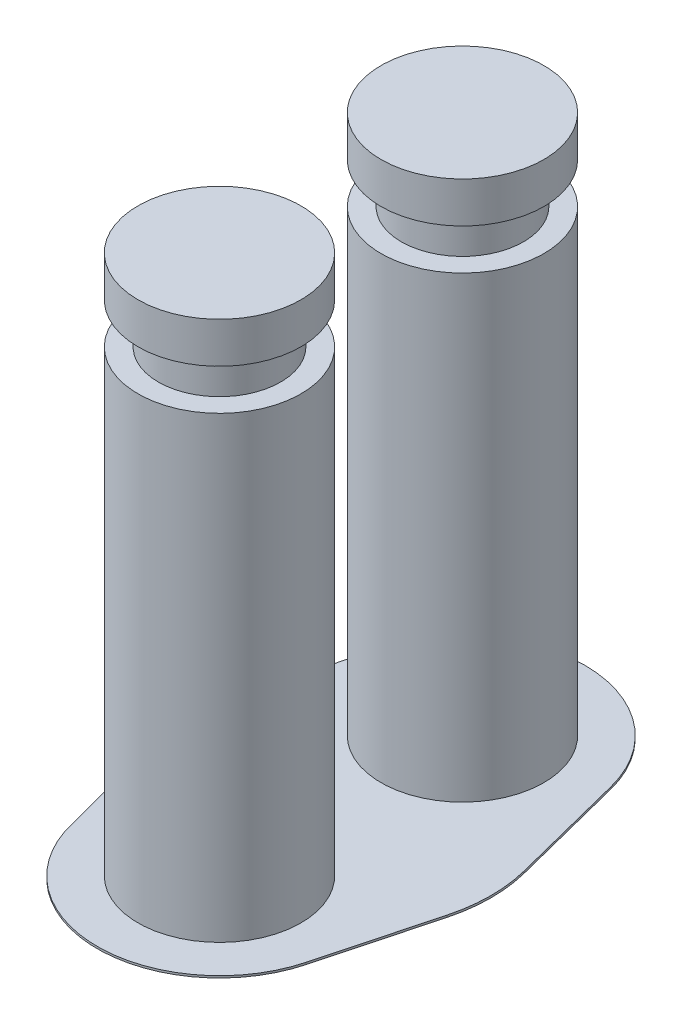
from build123d import *

# Parameters (mm, degrees)
BOSS_EXTRUDE2_DEPTH            = 0.1
SKETCH3_R                      = 4
BOSS_EXTRUDE3_DEPTH            = 22.5
SKETCH4_R                      = 3
BOSS_EXTRUDE4_DEPTH            = 2
SKETCH5_R                      = 4
BOSS_EXTRUDE5_DEPTH            = 2
SKETCH7_W                      = 1.89865
SKETCH7_H                      = 0.1
F_6_CLEARANCE_HOLE1_AT_2_COUNT = 2
F_6_CLEARANCE_HOLE1_AT_2_PITCH = 11.930689284
F_6_32_TAPPED_HOLE1_D          = 2.7051
F_6_32_TAPPED_HOLE1_DEPTH      = 9.39
F_6_32_TAPPED_HOLE1_TIP        = 0.81269403


with BuildPart() as part:
    # Sketch2 → Boss-Extrude2 (new body)
    with BuildSketch(Plane(origin=(0, 0, 0), x_dir=(1, 0, 0), z_dir=(0, 1, 0))):
        with BuildLine():
            ThreePointArc((-1.921673483, -7.798539123), (3.967844549, -11.837003018), (9.548776015, -7.381801872))
            Line((9.548776015, -7.381801872), (10.998470019, -1.926053578))
            ThreePointArc((10.998470019, -1.926053578), (11.24988985, -0.04064778), (11.018921171, 1.84737246))
            Line((11.018921171, 1.84737246), (9.565136937, 7.567628243))
            ThreePointArc((9.565136937, 7.567628243), (3.75, 12.089730275), (-2.065136937, 7.567628243))
            Line((-2.065136937, 7.567628243), (-3.518921171, 1.84737246))
            ThreePointArc((-3.518921171, 1.84737246), (-3.749830525, -0.050419155), (-3.493426606, -1.944934706))
            Line((-3.493426606, -1.944934706), (-1.921673483, -7.798539123))
        make_face()
    extrude(amount=BOSS_EXTRUDE2_DEPTH)

    # Sketch3 → Boss-Extrude3 (add)
    with BuildSketch(Plane(origin=(0, 0.1, 0), x_dir=(1, 0, 0), z_dir=(0, 1, 0))):
        with Locations(Location((3.75, -5.840959009, 0), (0, 0, 90))):
            Circle(SKETCH3_R)
        with Locations(Location((3.75, 6.089730275, 0), (0, 0, 90))):
            Circle(SKETCH3_R)
    extrude(amount=BOSS_EXTRUDE3_DEPTH)

    # Sketch4 → Boss-Extrude4 (add)
    with BuildSketch(Plane(origin=(0, 22.6, 0), x_dir=(1, 0, 0), z_dir=(0, 1, 0))):
        with Locations(Location((3.75, -5.840959009, 0), (0, 0, 270))):
            Circle(SKETCH4_R)
        with Locations(Location((3.75, 6.089730275, 0), (0, 0, 270))):
            Circle(SKETCH4_R)
    extrude(amount=BOSS_EXTRUDE4_DEPTH)

    # Sketch5 → Boss-Extrude5 (add)
    with BuildSketch(Plane(origin=(0, 24.6, 0), x_dir=(1, 0, 0), z_dir=(0, 1, 0))):
        with Locations(Location((3.75, -5.840959009, 0), (0, 0, 90))):
            Circle(SKETCH5_R)
        with Locations(Location((3.75, 6.089730275, 0), (0, 0, 90))):
            Circle(SKETCH5_R)
    extrude(amount=BOSS_EXTRUDE5_DEPTH)

    # Sketch7 → #6 Clearance Hole1 (revolve, cut)
    with BuildSketch(Plane(origin=(3.75, 0.1, -6.089730275), x_dir=(0, 0, 1), z_dir=(1, 0, 0))):
        with Locations((0.949325, 0.05)):
            Rectangle(SKETCH7_W, SKETCH7_H)
    f_6_clearance_hole1 = revolve(axis=Axis((3.75, 6.45, -6.089730275), (0, -1, 0)), mode=Mode.SUBTRACT)

    # #6 Clearance Hole1 at 2: #6 Clearance Hole1 ×2
    with Locations(*[(0, 0, i * F_6_CLEARANCE_HOLE1_AT_2_PITCH) for i in range(1, F_6_CLEARANCE_HOLE1_AT_2_COUNT)]):
        add(f_6_clearance_hole1, mode=Mode.SUBTRACT)

    # #6-32 Tapped Hole1
    with Locations(Plane(origin=(0, 0.1, 0), x_dir=(-1, 0, 0), z_dir=(0, -1, 0))):
        with Locations((-3.75, -5.840959009), (-3.75, 6.089730275)):
            Hole(F_6_32_TAPPED_HOLE1_D / 2, depth=F_6_32_TAPPED_HOLE1_DEPTH)
            with Locations((0, 0, -(F_6_32_TAPPED_HOLE1_DEPTH + F_6_32_TAPPED_HOLE1_TIP / 2))):  # 118° drill point
                Cone(0, F_6_32_TAPPED_HOLE1_D / 2, F_6_32_TAPPED_HOLE1_TIP, mode=Mode.SUBTRACT)


solid = part.part
